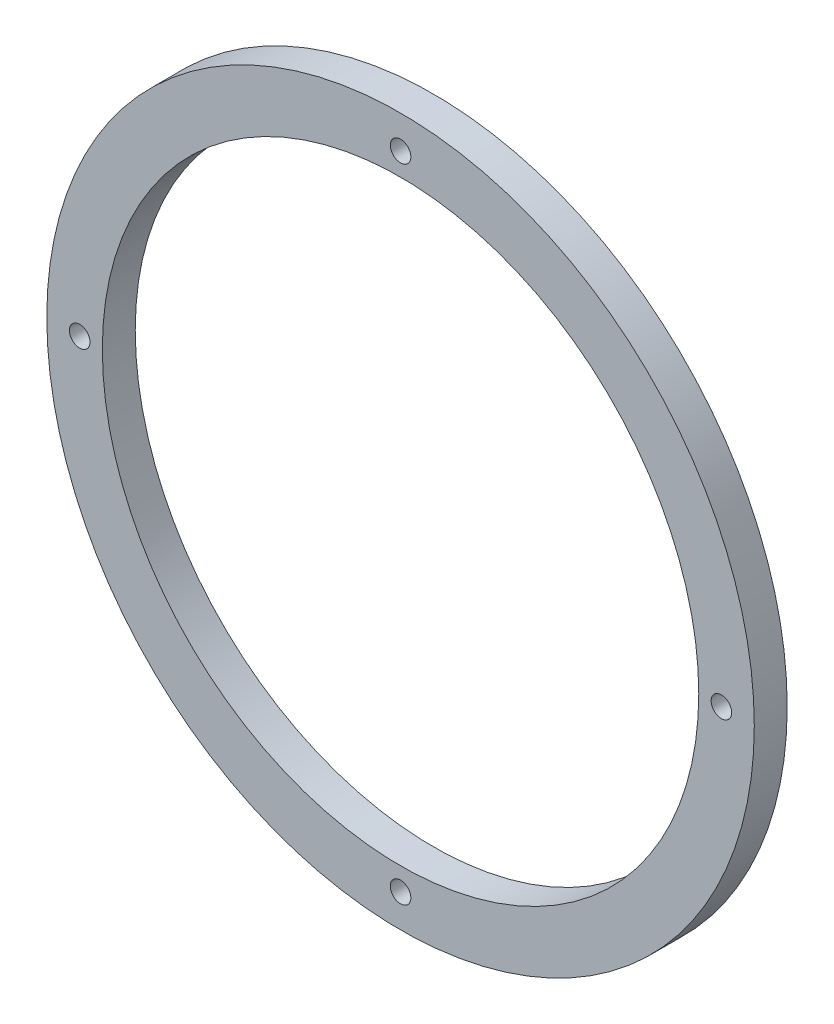
from build123d import *

# Parameters (mm, degrees)
SKETCH1_R           = 86
SKETCH1_R_2         = 72.5
SKETCH1_R_3         = 2.5
BOSS_EXTRUDE1_DEPTH = 8


with BuildPart() as part:
    # Sketch1 → Boss-Extrude1 (new body)
    with BuildSketch(Plane.XY):
        Circle(SKETCH1_R)
        Circle(SKETCH1_R_2, mode=Mode.SUBTRACT)
        with Locations((0, 78)):
            Circle(SKETCH1_R_3, mode=Mode.SUBTRACT)
        with Locations((78, 0)):
            Circle(SKETCH1_R_3, mode=Mode.SUBTRACT)
        with Locations((0, -78)):
            Circle(SKETCH1_R_3, mode=Mode.SUBTRACT)
        with Locations((-78, 0)):
            Circle(SKETCH1_R_3, mode=Mode.SUBTRACT)
    extrude(amount=BOSS_EXTRUDE1_DEPTH)


solid = part.part
